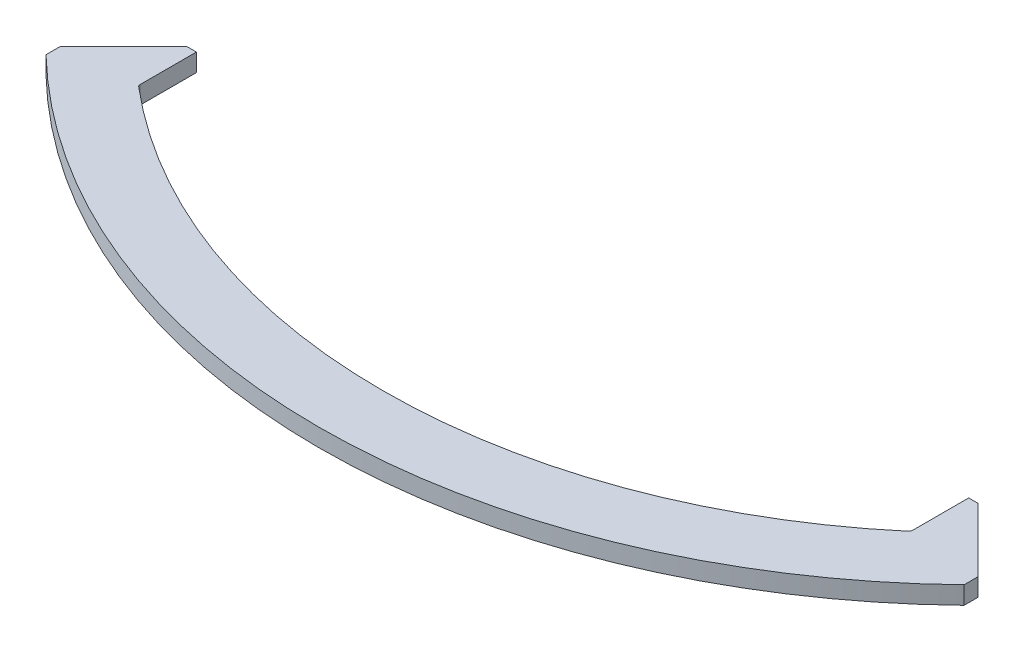
from build123d import *

# Parameters (mm, degrees)
BOSS_EXTRUDE1_DEPTH = 18.25625
FILLET1_R           = 3.3782


with BuildPart() as part:
    # Sketch3 → Boss-Extrude1 (new body)
    with BuildSketch(Plane(origin=(0, 0, 0), x_dir=(1, 0, 0), z_dir=(0, 1, 0))):
        with BuildLine():
            Line((469.9, -484.145858865), (469.9, -469.9))
            Line((469.9, -469.9), (404.8125, -404.8125))
            Line((404.8125, -404.8125), (395.2875, -404.8125))
            Line((395.2875, -404.8125), (395.2875, -464.068909047))
            ThreePointArc((395.2875, -464.068909047), (0, -609.6), (-395.2875, -464.068909047))
            Line((-395.2875, -464.068909047), (-395.2875, -404.8125))
            Line((-395.2875, -404.8125), (-404.8125, -404.8125))
            Line((-404.8125, -404.8125), (-469.9, -469.9))
            Line((-469.9, -469.9), (-469.9, -484.145858865))
            ThreePointArc((-469.9, -484.145858865), (0, -674.6875), (469.9, -484.145858865))
        make_face()
    extrude(amount=BOSS_EXTRUDE1_DEPTH)

    # Fillet1
    fillet1_edges = [part.edges().sort_by_distance(p)[0] for p in [
        (-395.2875, 9.128125, 464.068909047),
        (395.2875, 9.128125, 464.068909047),
    ]]
    fillet(fillet1_edges, radius=FILLET1_R)


solid = part.part
